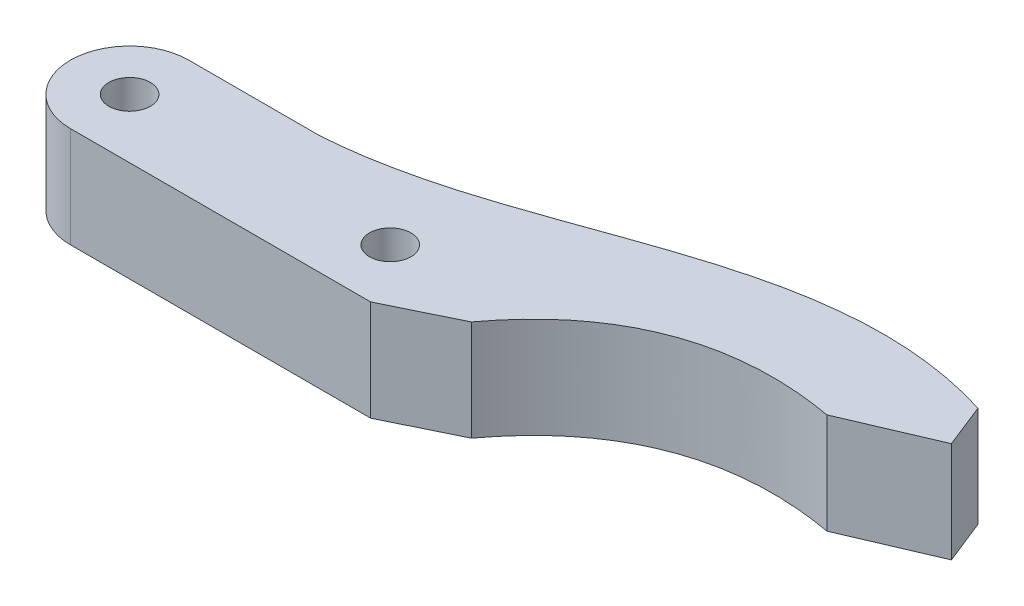
from build123d import *

# Parameters (mm, degrees)
SKETCH1_R           = 5
SKETCH1_R_2         = 1.75
BOSS_EXTRUDE2_DEPTH = 8.5
BOSS_EXTRUDE3_START = -8.5
BOSS_EXTRUDE3_DEPTH = 8.5


with BuildPart() as part:
    # Sketch1 → Boss-Extrude2 (new body)
    # profile 1 of 3: a face of its own
    with BuildSketch(Plane(origin=(0, 0, 0), x_dir=(1, 0, 0), z_dir=(0, 1, 0))):
        Circle(SKETCH1_R)
        with Locations(Location((0, 0, 0), (0, 0, 270))):
            Circle(SKETCH1_R_2, mode=Mode.SUBTRACT)
    # profile 2 of 3: a face of its own
    with BuildSketch(Plane(origin=(0, 0, 0), x_dir=(1, 0, 0), z_dir=(0, 1, 0))):
        with Locations((22, 0)):
            Circle(SKETCH1_R)
        with Locations(Location((22, 0, 0), (0, 0, 270))):
            Circle(SKETCH1_R_2, mode=Mode.SUBTRACT)
    # profile 3 of 3: a face of its own
    with BuildSketch(Plane(origin=(0, 0, 0), x_dir=(1, 0, 0), z_dir=(0, 1, 0))):
        with BuildLine():
            Line((0, 5), (22, 5))
            ThreePointArc((22, 5), (17, 0), (22, -5))
            Line((22, -5), (0, -5))
            ThreePointArc((0, -5), (5, 0), (0, 5))
        make_face()
    extrude(amount=BOSS_EXTRUDE2_DEPTH)

    # Sketch2 → Boss-Extrude3 (add)
    with BuildSketch(Plane(origin=(0, 8.5, 0), x_dir=(1, 0, 0), z_dir=(0, 1, 0)).offset(BOSS_EXTRUDE3_START)):
        with BuildLine():
            Line((22, -5), (25.346400572, -5))
            Line((25.346400572, -5), (31.061757845, -2.212434003))
            add(Edge.make_bspline(
                [(31.061757845, -2.212434003), (38.992757935, 8.50475737), (52.869115173, 6)],
                knots=[0, 0, 0, 1, 1, 1], degree=2))
            Line((52.869115173, 6), (60.222476385, 9.150885415))
            Line((60.222476385, 9.150885415), (58.75, 12.87))
            add(Edge.make_bspline(
                [(11, 5), (27.543585327, 6.057362318), (40.764199153, 18.426668213), (58.75, 12.87)],
                knots=[0, 0, 0, 0, 1, 1, 1, 1], degree=3))
            Line((11, 5), (22, 5))
            ThreePointArc((22, 5), (27, 0), (22, -5))
        make_face()
    extrude(amount=BOSS_EXTRUDE3_DEPTH)


solid = part.part
